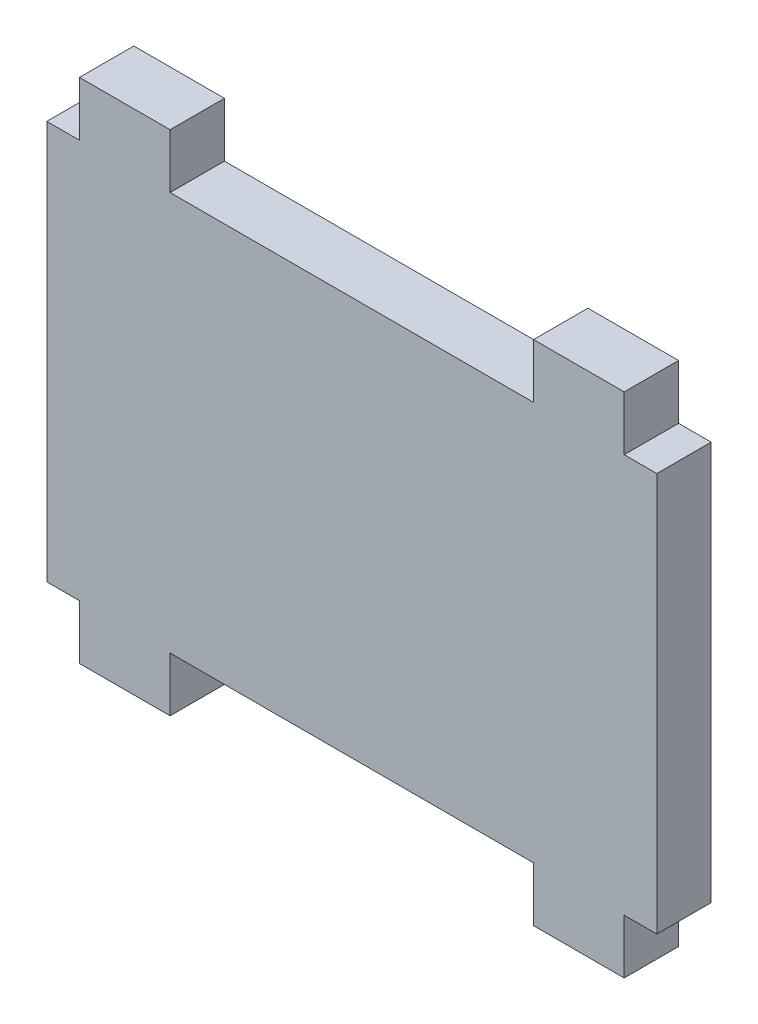
from build123d import *

# Parameters (mm, degrees)
SALIENTE_EXTRUIR1_DEPTH = 3


with BuildPart() as part:
    # Croquis3 → Saliente-Extruir1 (new body)
    with BuildSketch(Plane.XY):
        Polygon((8.6, 0), (25.05, 0), (26.85, 0), (26.85, -3), (31.85, -3), (31.85, 0), (33.65, 0), (33.65, 22), (31.85, 22), (31.85, 25), (26.85, 25), (26.85, 22), (6.8, 22), (6.8, 25), (1.8, 25), (1.8, 22), (0, 22), (0, 0), (1.8, 0), (1.8, -3), (6.8, -3), (6.8, 0), align=None)
    extrude(amount=SALIENTE_EXTRUIR1_DEPTH)


solid = part.part
